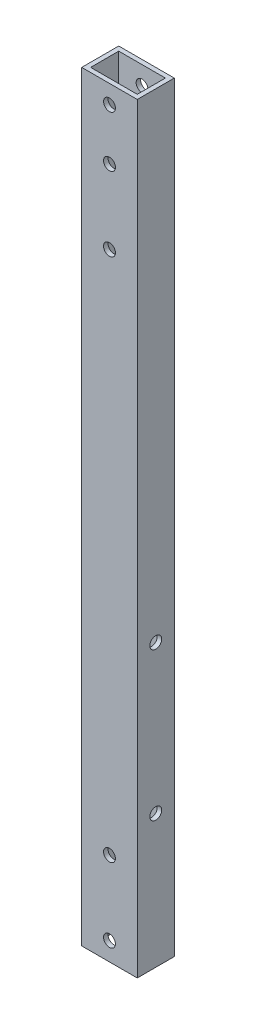
from build123d import *

# Parameters (mm, degrees)
SKETCH_1_W          = 15
SKETCH_1_H          = 10
SKETCH_1_W_2        = 12.6
SKETCH_1_H_2        = 7.6
EXTRUDE_1_DEPTH     = 110
SKETCH_2_R          = 1.6
CUT_EXTRUDE_1_DEPTH = 100
SKETCH_3_R          = 1.6
CUT_EXTRUDE_2_DEPTH = 15
SKETCH_5_W          = 15
SKETCH_5_H          = 10
CUT_EXTRUDE_4_DEPTH = 14.5
SKETCH_6_R          = 1.6
CUT_EXTRUDE_5_DEPTH = 15


with BuildPart() as part:
    # ｽｹｯﾁ1 → ﾎﾞｽ - 押し出し1 (new, symmetric)
    with BuildSketch(Plane(origin=(0, 0, 0), x_dir=(1, 0, 0), z_dir=(0, 1, 0))):
        Rectangle(SKETCH_1_W, SKETCH_1_H)
        Rectangle(SKETCH_1_W_2, SKETCH_1_H_2, mode=Mode.SUBTRACT)
    extrude(amount=EXTRUDE_1_DEPTH, both=True)

    # ｽｹｯﾁ2 → ｶｯﾄ - 押し出し1 (cut)
    with BuildSketch(Plane(origin=(0, 0, -5), x_dir=(-1, 0, 0), z_dir=(0, 0, -1))):
        with Locations((0, -85)):
            Circle(SKETCH_2_R)
        with Locations((0, -105)):
            Circle(SKETCH_2_R)
    extrude(amount=-CUT_EXTRUDE_1_DEPTH, mode=Mode.SUBTRACT)

    # ｽｹｯﾁ3 → ｶｯﾄ - 押し出し2 (cut)
    with BuildSketch(Plane(origin=(7.5, 0, 0), x_dir=(0, 0, -1), z_dir=(1, 0, 0))):
        with Locations((0, -34)):
            Circle(SKETCH_3_R)
        with Locations((0, -74)):
            Circle(SKETCH_3_R)
    extrude(amount=-CUT_EXTRUDE_2_DEPTH, mode=Mode.SUBTRACT)

    # ｽｹｯﾁ5 → ｶｯﾄ - 押し出し4 (cut)
    with BuildSketch(Plane(origin=(0, 110, 0), x_dir=(1, 0, 0), z_dir=(0, 1, 0))):
        Rectangle(SKETCH_5_W, SKETCH_5_H)
    extrude(amount=-CUT_EXTRUDE_4_DEPTH, mode=Mode.SUBTRACT)

    # ｽｹｯﾁ6 → ｶｯﾄ - 押し出し5 (cut)
    with BuildSketch(Plane(origin=(0, 0, -5), x_dir=(-1, 0, 0), z_dir=(0, 0, -1))):
        with Locations((0, 90.5)):
            Circle(SKETCH_6_R)
        with Locations((0, 76.66)):
            Circle(SKETCH_6_R)
        with Locations((0, 56.66)):
            Circle(SKETCH_6_R)
    extrude(amount=-CUT_EXTRUDE_5_DEPTH, mode=Mode.SUBTRACT)


solid = part.part
